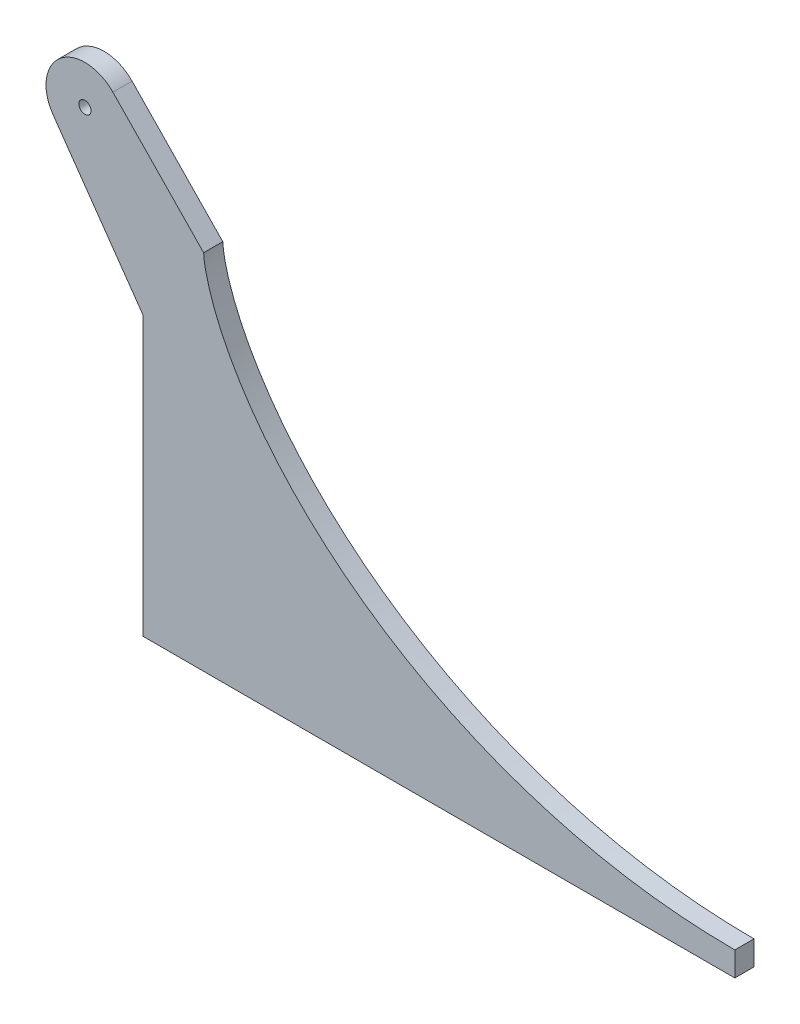
from build123d import *

# Parameters (mm, degrees)
BOSS_EXTRUDE1_DEPTH = 2.5
SKETCH3_R           = 1.5875
CUT_EXTRUDE1_DEPTH  = 214.852130583


with BuildPart() as part:
    # Sketch1 → Boss-Extrude1 (new, symmetric)
    with BuildSketch(Plane.XY):
        with BuildLine():
            Line((-154.481439558, -6.35), (-154.481439558, 66.347378373))
            Line((-154.481439558, 66.347378373), (-177.895895312, 99.786686688))
            ThreePointArc((-177.895895312, 99.786686688), (-176.041196233, 113.449531488), (-162.274426085, 112.681888078))
            Line((-162.274426085, 112.681888078), (-138.606439558, 88.2396))
            add(Edge.make_bspline(
                [(-138.606439558, 88.2396), (-138.606439558, 88.206480064), (-138.604893224, 88.134332137), (-138.597757085, 87.982040168), (-138.584504009, 87.767973581), (-138.563362589, 87.511833211), (-138.514302662, 87.023426652), (-138.425196169, 86.336581908), (-138.262733573, 85.340165391), (-137.997774346, 84.039042844), (-137.543893872, 82.163940465), (-136.709143666, 79.332808223), (-135.381511976, 75.692405853), (-133.427089014, 71.311625777), (-130.978665346, 66.686011286), (-128.248792738, 62.200876138), (-125.278396767, 57.871801388), (-121.922980854, 53.47598485), (-117.499907722, 48.25477976), (-111.846477366, 42.372548658), (-104.806706424, 36.032698765), (-96.481239759, 29.625824358), (-87.711829988, 23.843138375), (-78.562226684, 18.684637722), (-69.088219119, 14.150320925), (-59.340712588, 10.240190432), (-49.365347684, 6.954244107), (-41.111501611, 4.791563651), (-34.694119901, 3.420549472), (-30.177735786, 2.597379945), (-27.586849558, 2.166008761), (-24.349433278, 1.675559443), (-20.435573897, 1.165043535), (-15.888225625, 0.68322541), (-11.278370624, 0.337947753), (-7.392012303, 0.139524343), (-4.35262006, 0.048647043), (-2.477110072, 0.012428268), (-0.93320285, 0.001817838), (-0.315317676, 0), (0, 0)],
                knots=[0, 0, 0, 0, 0, 0.000750682, 0.001501364, 0.003002728, 0.004504092, 0.006005456, 0.011632897, 0.017260339, 0.025307868, 0.033355398, 0.051377592, 0.078047856, 0.105080676, 0.132113154, 0.15914583, 0.186178382, 0.213211084, 0.24601624, 0.3000815, 0.354146872, 0.408211991, 0.462277325, 0.516342503, 0.570407831, 0.624473028, 0.67853828, 0.732603517, 0.746119838, 0.759636158, 0.773152478, 0.786668798, 0.813701417, 0.840734035, 0.867766658, 0.88128297, 0.894799281, 0.901946134, 0.909092986, 0.909092986, 0.909092986, 0.909092986, 0.909092986], degree=4))
            Line((0, 0), (0, -6.35))
            Line((0, -6.35), (-154.481439558, -6.35))
        make_face()
    extrude(amount=BOSS_EXTRUDE1_DEPTH, both=True)

    # Sketch3 → Cut-Extrude1 (cut, through all)
    with BuildSketch(Plane.XY.offset(2.5)):
        with Locations((-169.573310542, 105.614223281)):
            Circle(SKETCH3_R)
    extrude(amount=-CUT_EXTRUDE1_DEPTH, mode=Mode.SUBTRACT)


solid = part.part
